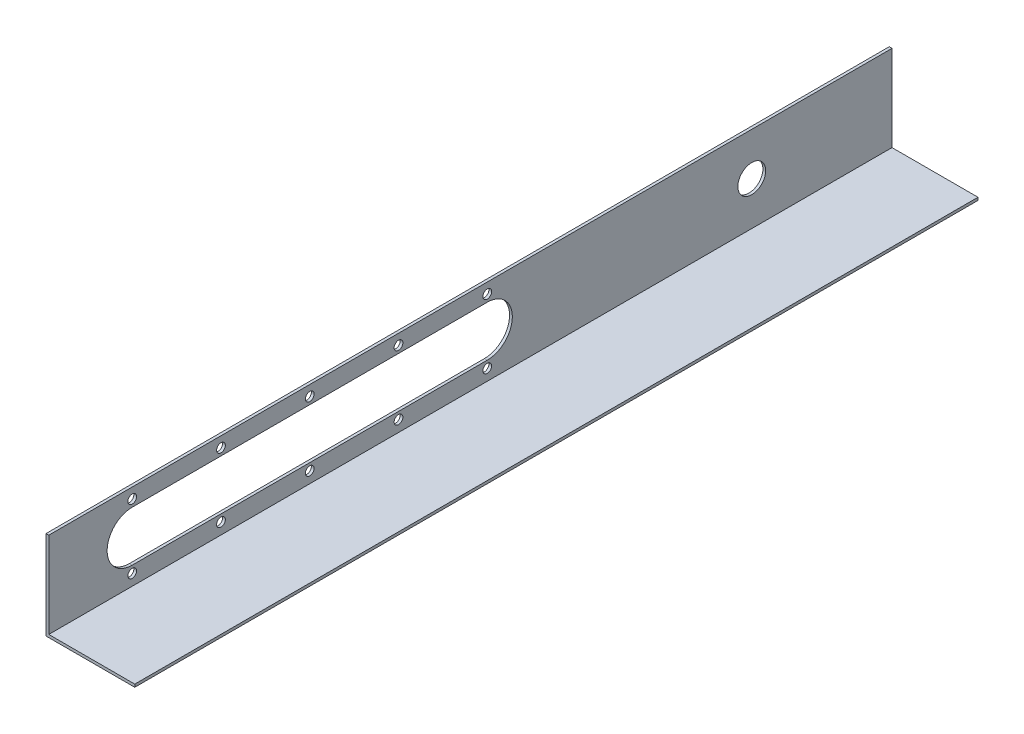
from build123d import *

# Parameters (mm, degrees)
BOSS_EXTRUDE2_DEPTH          = 482.6
CUT_EXTRUDE3_DEPTH           = 488.592555637
SKETCH7_R                    = 7.9629
CUT_EXTRUDE4_DEPTH           = 488.592555637
F_10_0_1935_DIAMETER_HOLE1_D = 4.999999906


with BuildPart() as part:
    # Sketch3 → Boss-Extrude2 (new body)
    with BuildSketch(Plane.XY):
        Polygon((0, 0), (0, 49.2125), (-1.5875, 49.2125), (-1.5875, -1.5875), (49.2125, -1.5875), (49.2125, 0), align=None)
    extrude(amount=BOSS_EXTRUDE2_DEPTH)

    # Sketch6 → Cut-Extrude3 (cut, through all)
    with BuildSketch(Plane(origin=(0, 0, 0), x_dir=(0, 0, -1), z_dir=(1, 0, 0))):
        with BuildLine():
            Line((-434.848, 39.1795), (-231.648, 39.1795))
            ThreePointArc((-231.648, 39.1795), (-217.297, 24.8285), (-231.648, 10.4775))
            Line((-231.648, 10.4775), (-434.848, 10.4775))
            ThreePointArc((-434.848, 10.4775), (-449.199, 24.8285), (-434.848, 39.1795))
        make_face()
    extrude(amount=-CUT_EXTRUDE3_DEPTH, mode=Mode.SUBTRACT)

    # Sketch7 → Cut-Extrude4 (cut, through all)
    with BuildSketch(Plane(origin=(0, 0, 0), x_dir=(0, 0, -1), z_dir=(1, 0, 0))):
        with Locations(Location((-80.264, 24.773594829, 0), (0, 0, 90))):
            Circle(SKETCH7_R)
    extrude(amount=-CUT_EXTRUDE4_DEPTH, mode=Mode.SUBTRACT)

    # #10 (0.1935) Diameter Hole1 (through all)
    with Locations(Plane(origin=(0, 0, 0), x_dir=(0, 0, -1), z_dir=(1, 0, 0))):
        with Locations((-434.848, 43.2435), (-384.048, 43.2435), (-333.248, 43.2435), (-282.448, 43.2435), (-231.648, 43.2435), (-231.648, 6.4135), (-282.448, 6.4135), (-333.248, 6.4135), (-384.048, 6.4135), (-434.848, 6.4135)):
            Hole(F_10_0_1935_DIAMETER_HOLE1_D / 2)


solid = part.part
